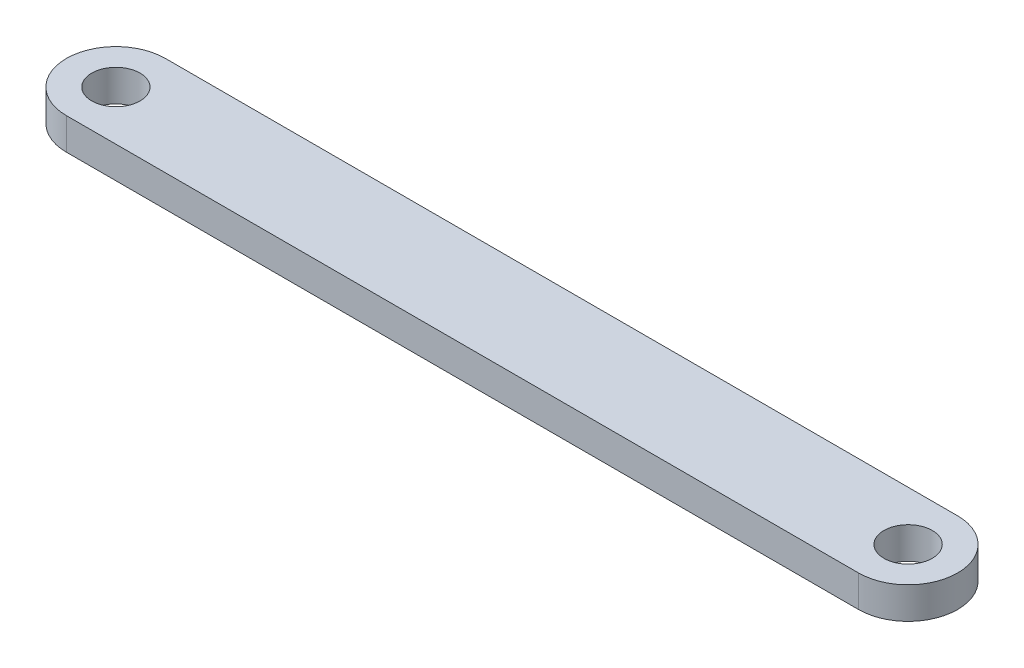
from build123d import *

# Parameters (mm, degrees)
SKETCH_1_R      = 6.1
EXTRUDE_1_DEPTH = 8


with BuildPart() as part:
    # 草图1 → 凸台-拉伸1 (new body)
    with BuildSketch(Plane(origin=(0, 0, 0), x_dir=(1, 0, 0), z_dir=(0, 1, 0))):
        with BuildLine():
            Line((0, 12.5), (200, 12.5))
            ThreePointArc((200, 12.5), (212.5, 0), (200, -12.5))
            Line((200, -12.5), (0, -12.5))
            ThreePointArc((0, -12.5), (-12.5, 0), (0, 12.5))
        make_face()
        with Locations(Location((0, 0, 0), (0, 0, 270))):
            Circle(SKETCH_1_R, mode=Mode.SUBTRACT)
        with Locations(Location((200, 0, 0), (0, 0, 270))):
            Circle(SKETCH_1_R, mode=Mode.SUBTRACT)
    extrude(amount=EXTRUDE_1_DEPTH)


solid = part.part
